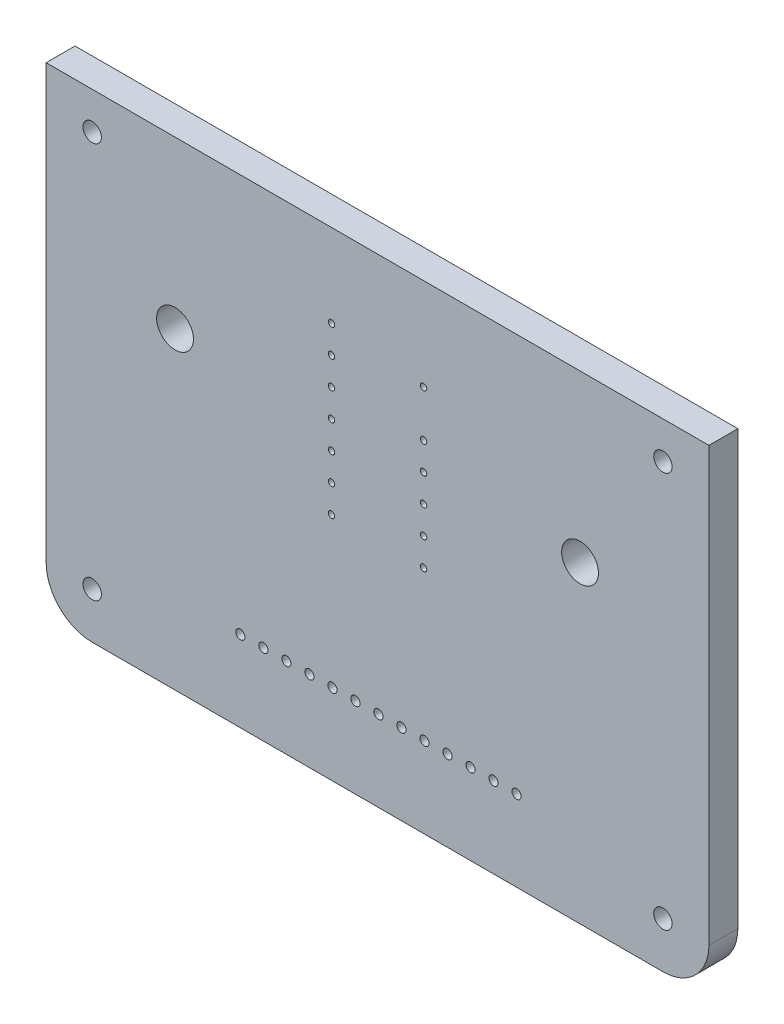
from build123d import *

# Parameters (mm, degrees)
ESQUISSE1_W             = 36
ESQUISSE1_H             = 26.01
ESQUISSE1_R             = 0.175
ESQUISSE1_R_2           = 0.5
ESQUISSE1_R_3           = 0.25
BOSS_EXTRU_1_DEPTH      = 1.57
ENL_V_MAT_EXTRU_1_REACH = 46.441
ESQUISSE2_R             = 1
CONG_1_R                = 2.5


with BuildPart() as part:
    # Esquisse1 → Boss.-Extru.1 (new body)
    with BuildSketch(Plane(origin=(0, 0, 0), x_dir=(-1, 0, 0), z_dir=(0, 0, -1))):
        with Locations((-18, 13.005)):
            Rectangle(ESQUISSE1_W, ESQUISSE1_H)
        with Locations(Location((-15.5, 21.5, 0), (0, 0, 180))):
            Circle(ESQUISSE1_R, mode=Mode.SUBTRACT)
        with Locations(Location((-15.5, 20, 0), (0, 0, 180))):
            Circle(ESQUISSE1_R, mode=Mode.SUBTRACT)
        with Locations(Location((-15.5, 18.5, 0), (0, 0, 180))):
            Circle(ESQUISSE1_R, mode=Mode.SUBTRACT)
        with Locations(Location((-15.5, 15.5, 0), (0, 0, 180))):
            Circle(ESQUISSE1_R, mode=Mode.SUBTRACT)
        with Locations(Location((-15.5, 17, 0), (0, 0, 180))):
            Circle(ESQUISSE1_R, mode=Mode.SUBTRACT)
        with Locations(Location((-15.5, 12.5, 0), (0, 0, 180))):
            Circle(ESQUISSE1_R, mode=Mode.SUBTRACT)
        with Locations(Location((-15.5, 14, 0), (0, 0, 180))):
            Circle(ESQUISSE1_R, mode=Mode.SUBTRACT)
        with Locations(Location((-7, 17, 0), (0, 0, 180))):
            Circle(ESQUISSE1_R_2, mode=Mode.SUBTRACT)
        with Locations(Location((-20.5, 21, 0), (0, 0, 180))):
            Circle(ESQUISSE1_R, mode=Mode.SUBTRACT)
        with Locations(Location((-20.5, 18.5, 0), (0, 0, 180))):
            Circle(ESQUISSE1_R, mode=Mode.SUBTRACT)
        with Locations(Location((-20.5, 15.5, 0), (0, 0, 180))):
            Circle(ESQUISSE1_R, mode=Mode.SUBTRACT)
        with Locations(Location((-20.5, 17, 0), (0, 0, 180))):
            Circle(ESQUISSE1_R, mode=Mode.SUBTRACT)
        with Locations(Location((-20.5, 12.5, 0), (0, 0, 180))):
            Circle(ESQUISSE1_R, mode=Mode.SUBTRACT)
        with Locations(Location((-20.5, 14, 0), (0, 0, 180))):
            Circle(ESQUISSE1_R, mode=Mode.SUBTRACT)
        with Locations(Location((-2.5, 24, 0), (0, 0, 180))):
            Circle(ESQUISSE1_R_2, mode=Mode.SUBTRACT)
        with Locations(Location((-29, 17, 0), (0, 0, 180))):
            Circle(ESQUISSE1_R_2, mode=Mode.SUBTRACT)
        with Locations(Location((-2.5, 2.5, 0), (0, 0, 180))):
            Circle(ESQUISSE1_R_2, mode=Mode.SUBTRACT)
        with Locations(Location((-33.5, 2.5, 0), (0, 0, 180))):
            Circle(ESQUISSE1_R_2, mode=Mode.SUBTRACT)
        with Locations(Location((-33.5, 24, 0), (0, 0, 180))):
            Circle(ESQUISSE1_R_2, mode=Mode.SUBTRACT)
        with Locations(Location((-10.55, 4.39, 0), (0, 0, 180))):
            Circle(ESQUISSE1_R_3, mode=Mode.SUBTRACT)
        with Locations(Location((-13.05, 4.39, 0), (0, 0, 180))):
            Circle(ESQUISSE1_R_3, mode=Mode.SUBTRACT)
        with Locations(Location((-15.55, 4.39, 0), (0, 0, 180))):
            Circle(ESQUISSE1_R_3, mode=Mode.SUBTRACT)
        with Locations(Location((-25.55, 4.39, 0), (0, 0, 180))):
            Circle(ESQUISSE1_R_3, mode=Mode.SUBTRACT)
        with Locations(Location((-19.3, 4.39, 0), (0, 0, 180))):
            Circle(ESQUISSE1_R_3, mode=Mode.SUBTRACT)
        with Locations(Location((-21.8, 4.39, 0), (0, 0, 180))):
            Circle(ESQUISSE1_R_3, mode=Mode.SUBTRACT)
        with Locations(Location((-24.3, 4.39, 0), (0, 0, 180))):
            Circle(ESQUISSE1_R_3, mode=Mode.SUBTRACT)
        with Locations(Location((-23.05, 4.39, 0), (0, 0, 180))):
            Circle(ESQUISSE1_R_3, mode=Mode.SUBTRACT)
        with Locations(Location((-20.55, 4.39, 0), (0, 0, 180))):
            Circle(ESQUISSE1_R_3, mode=Mode.SUBTRACT)
        with Locations(Location((-18.05, 4.39, 0), (0, 0, 180))):
            Circle(ESQUISSE1_R_3, mode=Mode.SUBTRACT)
        with Locations(Location((-16.8, 4.39, 0), (0, 0, 180))):
            Circle(ESQUISSE1_R_3, mode=Mode.SUBTRACT)
        with Locations(Location((-14.3, 4.39, 0), (0, 0, 180))):
            Circle(ESQUISSE1_R_3, mode=Mode.SUBTRACT)
        with Locations(Location((-11.8, 4.39, 0), (0, 0, 180))):
            Circle(ESQUISSE1_R_3, mode=Mode.SUBTRACT)
    extrude(amount=-BOSS_EXTRU_1_DEPTH)

    # Esquisse2 → Enlèv. mat.-Extru.1 (cut, up to next)
    with BuildSketch(Plane.XY.offset(1.57), mode=Mode.PRIVATE) as enl_v_mat_extru_1_sk1:
        with Locations((7, 17)):
            Circle(ESQUISSE2_R)
    enl_v_mat_extru_1_tool1 = extrude(enl_v_mat_extru_1_sk1.sketch, amount=-ENL_V_MAT_EXTRU_1_REACH, mode=Mode.PRIVATE) & part.part
    # Esquisse2 → Enlèv. mat.-Extru.1 (cut, up to next)
    with BuildSketch(Plane.XY.offset(1.57), mode=Mode.PRIVATE) as enl_v_mat_extru_1_sk2:
        with Locations((29, 17)):
            Circle(ESQUISSE2_R)
    enl_v_mat_extru_1_tool2 = extrude(enl_v_mat_extru_1_sk2.sketch, amount=-ENL_V_MAT_EXTRU_1_REACH, mode=Mode.PRIVATE) & part.part
    add(enl_v_mat_extru_1_tool1.solids().sort_by_distance((7, 17, 1.57))[0], mode=Mode.SUBTRACT)
    add(enl_v_mat_extru_1_tool2.solids().sort_by_distance((29, 17, 1.57))[0], mode=Mode.SUBTRACT)

    # Congé1
    cong_1_edges = [part.edges().sort_by_distance(p)[0] for p in [
        (0, 0, 0.785),
        (36, 0, 0.785),
    ]]
    fillet(cong_1_edges, radius=CONG_1_R)


solid = part.part
